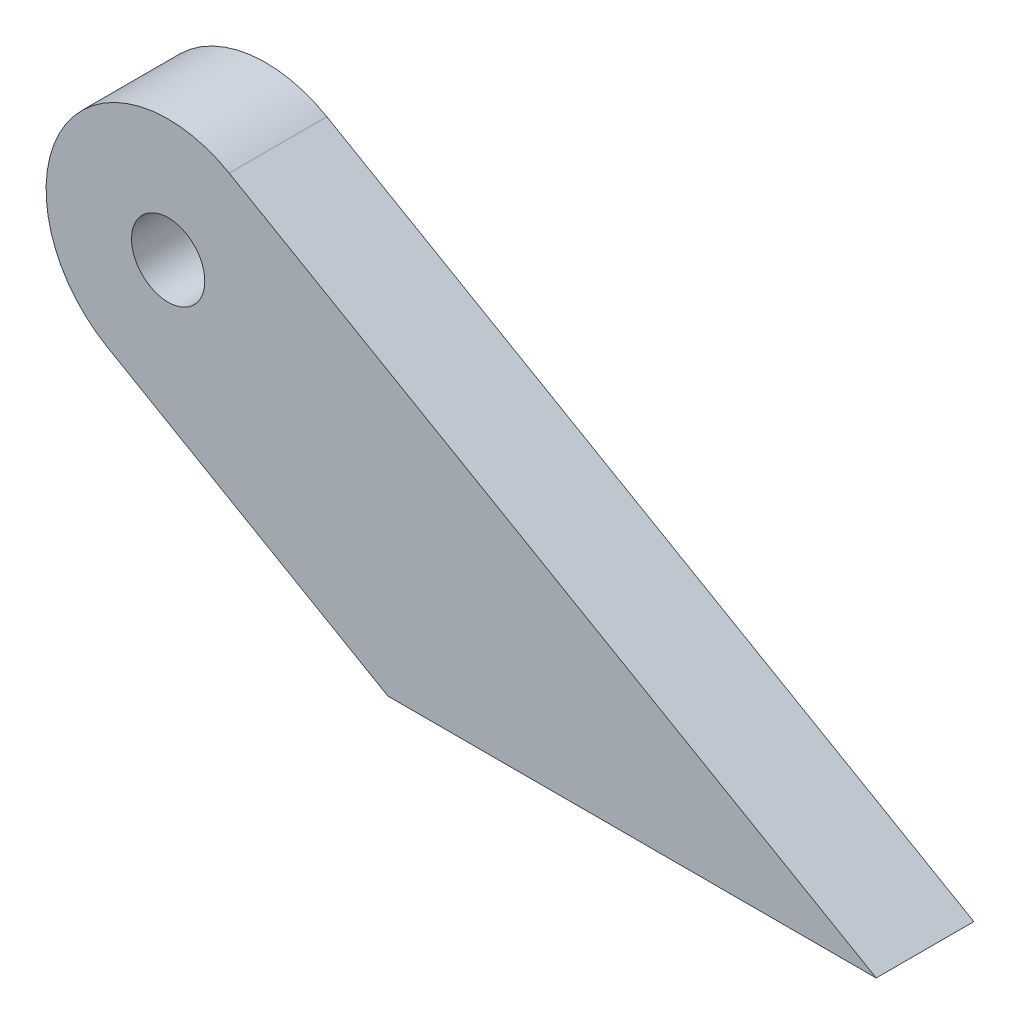
from build123d import *

# Parameters (mm, degrees)
SKETCH1_R           = 0.75
BOSS_EXTRUDE1_DEPTH = 2


with BuildPart() as part:
    # Sketch1 → Boss-Extrude1 (new body)
    with BuildSketch(Plane.XY):
        with BuildLine():
            Line((0, 0), (10, 0))
            Line((10, 0), (-3.25, 7.649891067))
            ThreePointArc((-3.25, 7.649891067), (-6.665063509, 6.734827557), (-5.75, 3.319764048))
            Line((-5.75, 3.319764048), (0, 0))
        make_face()
        with Locations((-4.5, 5.484827557)):
            Circle(SKETCH1_R, mode=Mode.SUBTRACT)
    extrude(amount=BOSS_EXTRUDE1_DEPTH)


solid = part.part
